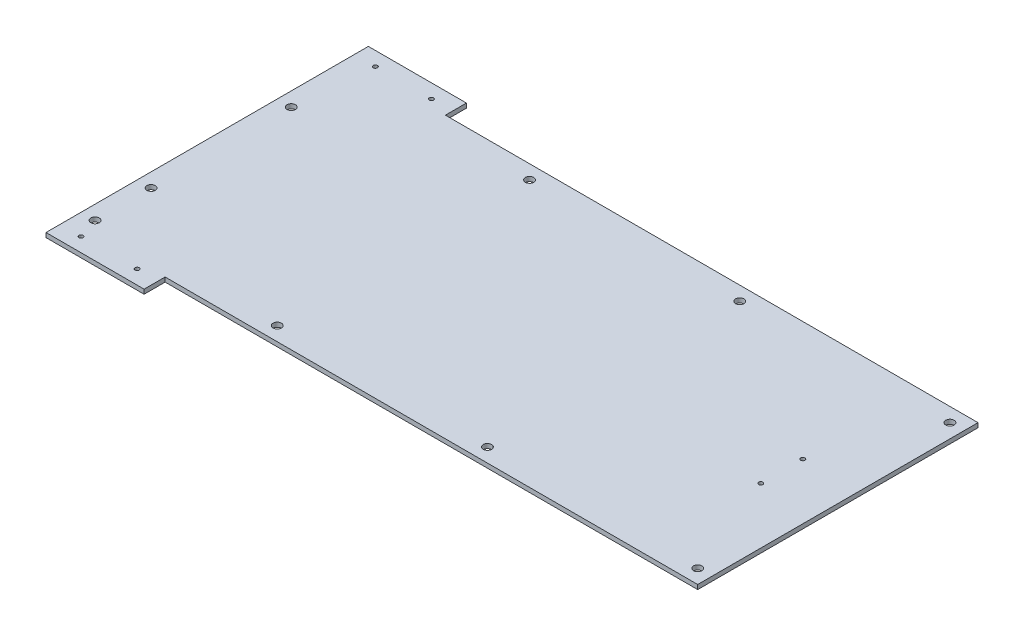
from build123d import *

# Parameters (mm, degrees)
SKETCH1_R           = 1.5
SKETCH1_R_2         = 3
BOSS_EXTRUDE1_DEPTH = 3.175


with BuildPart() as part:
    # Sketch1 → Boss-Extrude1 (new body)
    with BuildSketch(Plane(origin=(0, 0, 0), x_dir=(1, 0, 0), z_dir=(0, 1, 0))):
        Polygon((70, 110.468098835), (450, 110.468098835), (450, 310.468098835), (70, 310.468098835), (70, 325.468098835), (0, 325.468098835), (0, 95.468098835), (70, 95.468098835), align=None)
        with Locations(Location((55, 315.468098835, 0), (0, 0, 270))):
            Circle(SKETCH1_R, mode=Mode.SUBTRACT)
        with Locations(Location((15, 315.468098835, 0), (0, 0, 270))):
            Circle(SKETCH1_R, mode=Mode.SUBTRACT)
        with Locations(Location((55, 105.468098835, 0), (0, 0, 270))):
            Circle(SKETCH1_R, mode=Mode.SUBTRACT)
        with Locations(Location((15, 105.468098835, 0), (0, 0, 270))):
            Circle(SKETCH1_R, mode=Mode.SUBTRACT)
        with Locations(Location((410, 225.468098835, 0), (0, 0, 270))):
            Circle(SKETCH1_R, mode=Mode.SUBTRACT)
        with Locations(Location((410, 195.468098835, 0), (0, 0, 270))):
            Circle(SKETCH1_R, mode=Mode.SUBTRACT)
        with Locations(Location((10, 260.468098835, 0), (0, 0, 270))):
            Circle(SKETCH1_R_2, mode=Mode.SUBTRACT)
        with Locations(Location((440, 300.468098835, 0), (0, 0, 270))):
            Circle(SKETCH1_R_2, mode=Mode.SUBTRACT)
        with Locations(Location((140, 300.468098835, 0), (0, 0, 270))):
            Circle(SKETCH1_R_2, mode=Mode.SUBTRACT)
        with Locations(Location((290, 300.468098835, 0), (0, 0, 270))):
            Circle(SKETCH1_R_2, mode=Mode.SUBTRACT)
        with Locations(Location((440, 120.468098835, 0), (0, 0, 90))):
            Circle(SKETCH1_R_2, mode=Mode.SUBTRACT)
        with Locations(Location((290, 120.468098835, 0), (0, 0, 90))):
            Circle(SKETCH1_R_2, mode=Mode.SUBTRACT)
        with Locations(Location((140, 120.468098835, 0), (0, 0, 90))):
            Circle(SKETCH1_R_2, mode=Mode.SUBTRACT)
        with Locations(Location((10, 120.468098835, 0), (0, 0, 90))):
            Circle(SKETCH1_R_2, mode=Mode.SUBTRACT)
        with Locations(Location((10, 160.468098835, 0), (0, 0, 90))):
            Circle(SKETCH1_R_2, mode=Mode.SUBTRACT)
    extrude(amount=BOSS_EXTRUDE1_DEPTH)


solid = part.part
